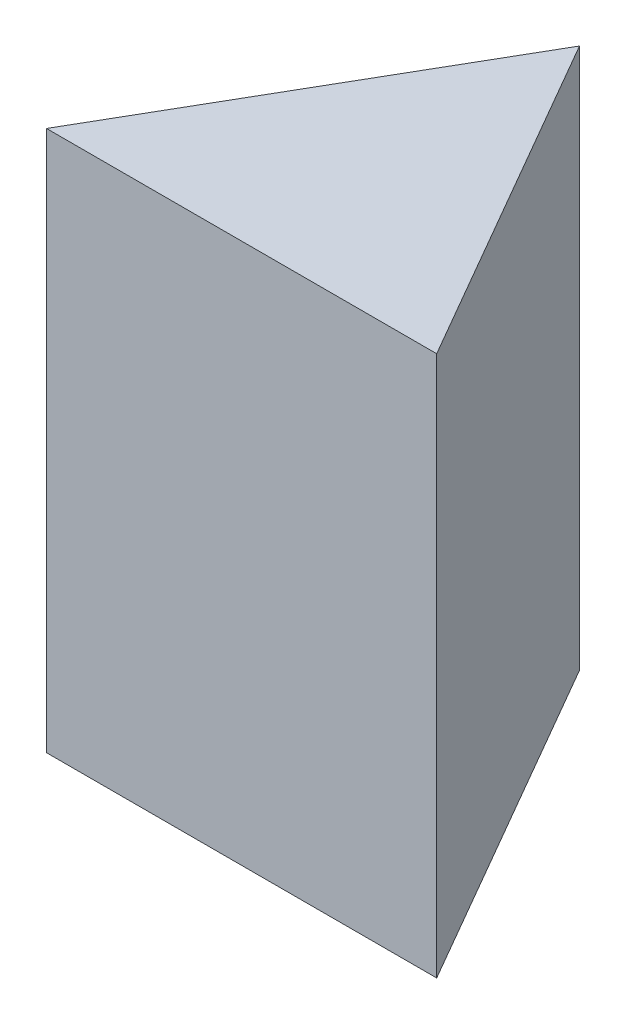
from build123d import *

# Parameters (mm, degrees)
EXTRUDE_1_DEPTH = 60


with BuildPart() as part:
    # 草图1 → 凸台-拉伸1 (new body)
    with BuildSketch(Plane(origin=(0, 0, 0), x_dir=(1, 0, 0), z_dir=(0, 1, 0))):
        Polygon((0, 37.5), (-21.650635095, 0), (0, 0), align=None)
        Polygon((0, 37.5), (0, 0), (21.650635095, 0), align=None)
    extrude(amount=EXTRUDE_1_DEPTH)


solid = part.part
